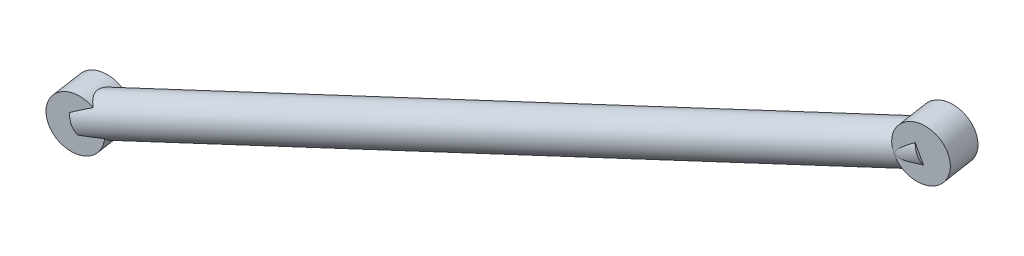
from build123d import *

# Parameters (mm, degrees)
SUSP_RR_TOE_LINK_PROFILE_R             = 8
SUSP_RR_TOE_LINK_ROD_END_IN_PROFILE_R  = 11
SUSP_RR_TOE_LINK_ROD_END_OUT_PROFILE_R = 11


with BuildPart() as part:
    # SUSP_RR_toe_link: sweep along a curve in space
    with BuildLine() as susp_rr_toe_link_path:
        Line((175, 1319.6, -94), (520.81, 1474.2, -108.53))
    # SUSP_RR_toe_link profile (on start of the path) → SUSP_RR_toe_link (sweep)
    with BuildSketch(Plane(origin=(175, 1319.6, -94), x_dir=(-0.40813623590833575, 0.9129210332436072, 0), z_dir=(0.9122501501575765, 0.4078363066839052, -0.03833028160489745))):
        Circle(SUSP_RR_TOE_LINK_PROFILE_R)
    sweep(path=susp_rr_toe_link_path.line)

    # SUSP_RR_toe_link_rod_end_in: sweep along a curve in space
    with BuildLine() as susp_rr_toe_link_rod_end_in_path:
        Line((176.034666, 1319.6, -87.076889), (173.965334, 1319.6, -100.923111))
    # SUSP_RR_toe_link_rod_end_in profile (on start of the path) → SUSP_RR_toe_link_rod_end_in (sweep)
    with BuildSketch(Plane(origin=(176.034666, 1319.6, -87.076889), x_dir=(-0.989015860676298, 0, 0.14780942909950529), z_dir=(-0.14780942909950529, 0, -0.989015860676298))):
        Circle(SUSP_RR_TOE_LINK_ROD_END_IN_PROFILE_R)
    sweep(path=susp_rr_toe_link_rod_end_in_path.line)

    # SUSP_RR_toe_link_rod_end_out: sweep along a curve in space
    with BuildLine() as susp_rr_toe_link_rod_end_out_path:
        Line((521.844666, 1474.2, -101.606889), (519.775334, 1474.2, -115.453111))
    # SUSP_RR_toe_link_rod_end_out profile (on start of the path) → SUSP_RR_toe_link_rod_end_out (sweep)
    with BuildSketch(Plane(origin=(521.844666, 1474.2, -101.606889), x_dir=(-0.9890158606762977, 0, 0.14780942909950728), z_dir=(-0.14780942909950728, 0, -0.9890158606762977))):
        Circle(SUSP_RR_TOE_LINK_ROD_END_OUT_PROFILE_R)
    sweep(path=susp_rr_toe_link_rod_end_out_path.line)


solid = part.part
